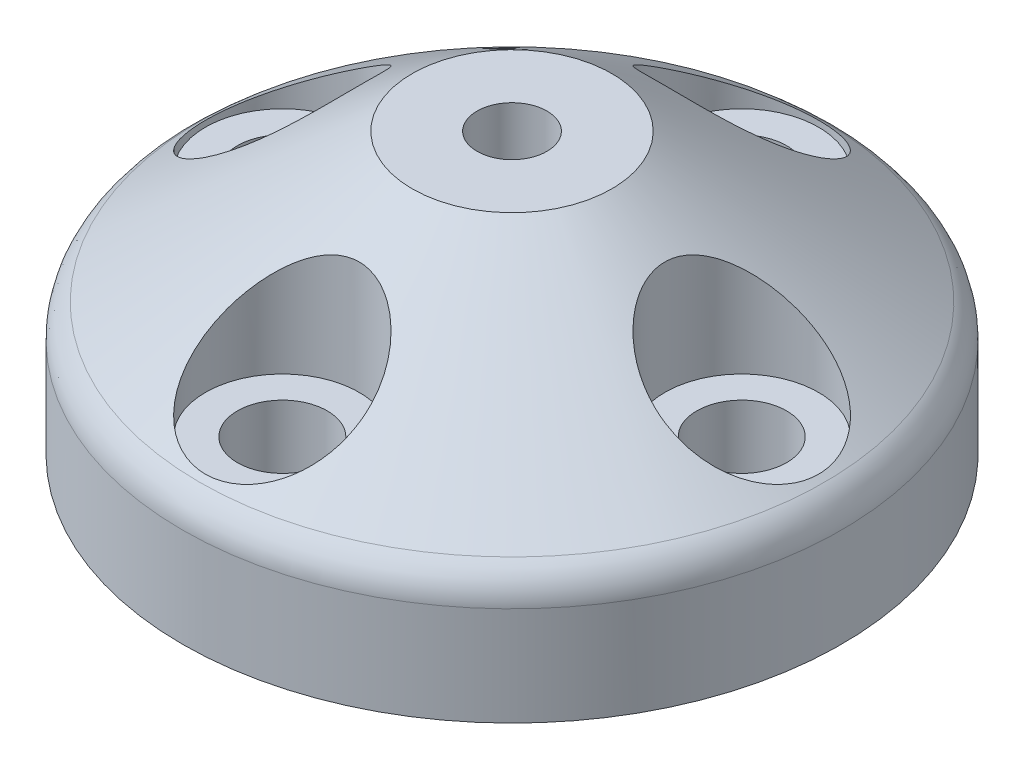
from build123d import *

# Parameters (mm, degrees)
SKETCH1_R           = 16.5
BOSS_EXTRUDE1_DEPTH = 6
SKETCH4_R           = 5
SKETCH6_R           = 3.85
CUT_EXTRUDE1_DEPTH  = 7.5
SKETCH7_R           = 1.75
CUT_EXTRUDE2_DEPTH  = 28.21212977
SKETCH9_R           = 2.25
CUT_EXTRUDE3_DEPTH  = 25.834452009
FILLET1_R           = 2
CUT_EXTRUDE4_DEPTH  = 2.5


with BuildPart() as part:
    # Sketch1 → Boss-Extrude1 (new body)
    with BuildSketch(Plane(origin=(0, 0, 0), x_dir=(1, 0, 0), z_dir=(0, 1, 0))):
        with Locations(Location((0, 0, 0), (0, 0, 270))):
            Circle(SKETCH1_R)
    extrude(amount=-BOSS_EXTRUDE1_DEPTH)

    # Sketch4 → section 0 of loft1
    with BuildSketch(Plane(origin=(0, 8, 0), x_dir=(1, 0, 0), z_dir=(0, 1, 0)), mode=Mode.PRIVATE) as loft1_s0:
        Circle(SKETCH4_R)
    # loft up to a face of the part (loft1)
    loft([loft1_s0.sketch, part.faces().sort_by_distance((0, 0, 0))[0]])

    # Sketch6 → Cut-Extrude1 (cut)
    with BuildSketch(Plane(origin=(0, 8, 0), x_dir=(1, 0, 0), z_dir=(0, 1, 0))):
        with Locations(Location((0, 11.5, 0), (0, 0, 270))):
            Circle(SKETCH6_R)
        with Locations(Location((11.5, 0, 0), (0, 0, 270))):
            Circle(SKETCH6_R)
        with Locations(Location((0, -11.5, 0), (0, 0, 270))):
            Circle(SKETCH6_R)
        with Locations(Location((-11.5, 0, 0), (0, 0, 270))):
            Circle(SKETCH6_R)
    extrude(amount=-CUT_EXTRUDE1_DEPTH, mode=Mode.SUBTRACT)

    # Sketch7 → Cut-Extrude2 (cut, through all)
    with BuildSketch(Plane(origin=(0, 8, 0), x_dir=(1, 0, 0), z_dir=(0, 1, 0))):
        with Locations(Location((0, 0, 0), (0, 0, 270))):
            Circle(SKETCH7_R)
    extrude(amount=-CUT_EXTRUDE2_DEPTH, mode=Mode.SUBTRACT)

    # Sketch9 → Cut-Extrude3 (cut, through all)
    with BuildSketch(Plane(origin=(0, 2.5, 0), x_dir=(1, 0, 0), z_dir=(0, 1, 0))):
        with Locations(Location((0, 11.5, 0), (0, 0, 270))):
            Circle(SKETCH9_R)
        with Locations(Location((11.5, 0, 0), (0, 0, 270))):
            Circle(SKETCH9_R)
        with Locations(Location((0, -11.5, 0), (0, 0, 270))):
            Circle(SKETCH9_R)
        with Locations(Location((-11.5, 0, 0), (0, 0, 270))):
            Circle(SKETCH9_R)
    extrude(amount=-CUT_EXTRUDE3_DEPTH, mode=Mode.SUBTRACT)

    # Fillet1
    fillet1_edges = [part.edges().sort_by_distance(p)[0] for p in [
        (11.66726189, 0, 11.66726189),
    ]]
    fillet(fillet1_edges, radius=FILLET1_R)

    # Sketch10 → Cut-Extrude4 (cut)
    with BuildSketch(Plane.XZ.offset(6)):
        Polygon((1.732050808, -3), (3.464101615, 0), (1.732050808, 3), (-1.732050808, 3), (-3.464101615, 0), (-1.732050808, -3), align=None)
    extrude(amount=-CUT_EXTRUDE4_DEPTH, mode=Mode.SUBTRACT)


solid = part.part
